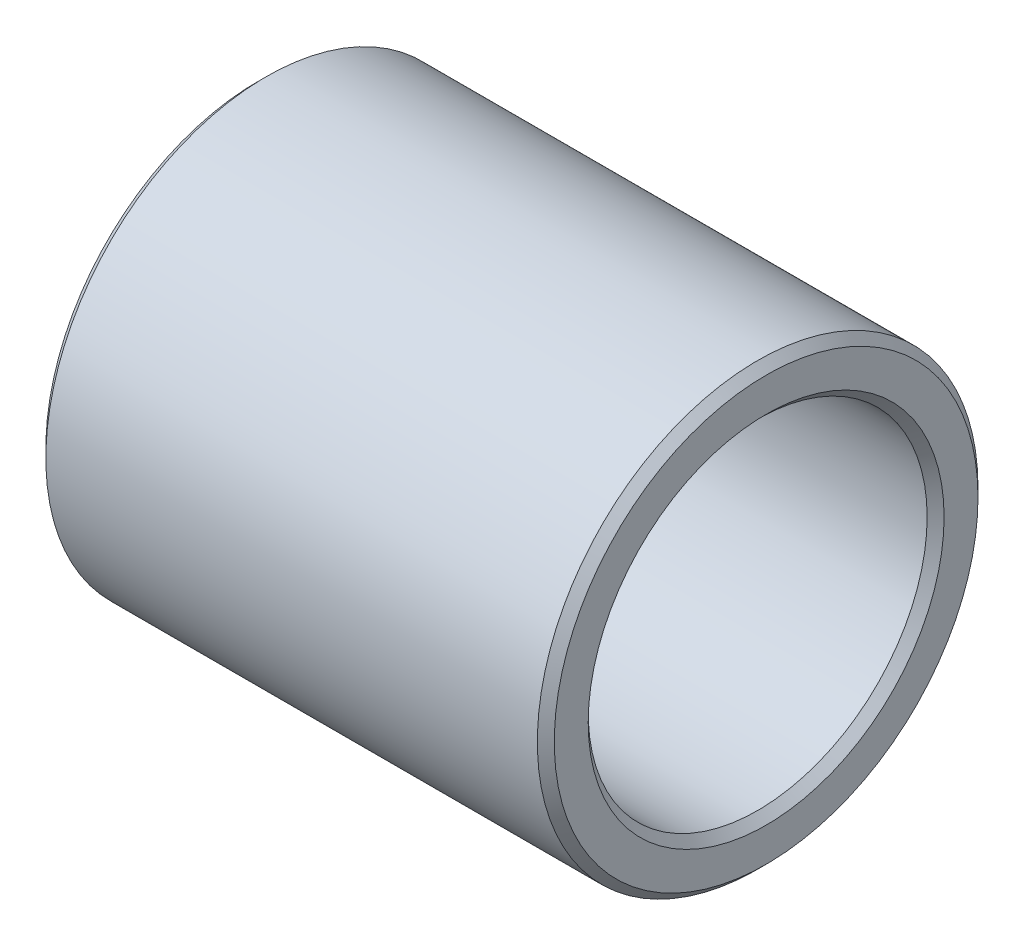
from build123d import *

# Parameters (mm, degrees)
SKETCH1_R           = 13
SKETCH1_R_2         = 10
BOSS_EXTRUDE1_DEPTH = 30
FILLET1_SIZE        = 0.5


with BuildPart() as part:
    # Sketch1 → Boss-Extrude1 (new body)
    with BuildSketch(Plane(origin=(0, 0, 0), x_dir=(0, 0, -1), z_dir=(1, 0, 0))):
        Circle(SKETCH1_R)
        Circle(SKETCH1_R_2, mode=Mode.SUBTRACT)
    extrude(amount=BOSS_EXTRUDE1_DEPTH)

    # Fillet1
    fillet1_edges = [part.edges().sort_by_distance(p)[0] for p in [
        (0, 0, 13),
        (30, 0, 13),
        (0, 0, 10),
        (30, 0, 10),
    ]]
    chamfer(fillet1_edges, length=FILLET1_SIZE)


solid = part.part
